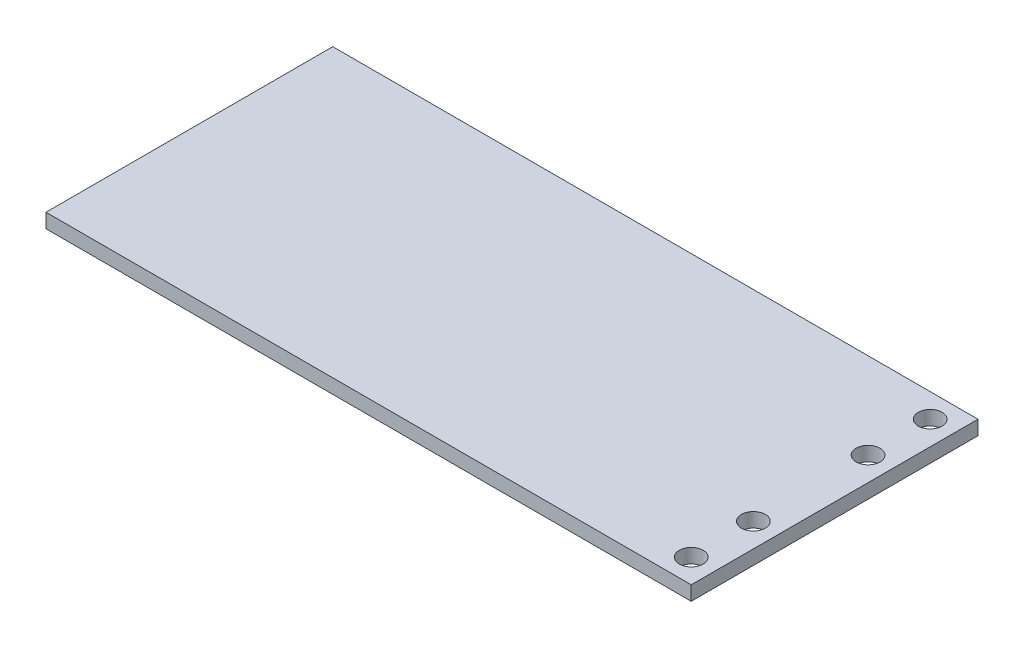
from build123d import *

# Parameters (mm, degrees)
BOSS_EXTRUDE1_DEPTH = 3


with BuildPart() as part:
    # Sketch1 → Boss-Extrude1 (new body)
    with BuildSketch(Plane(origin=(0, 0, 0), x_dir=(1, 0, 0), z_dir=(0, 1, 0))):
        with BuildLine():
            Line((130, 57.5), (130, 60))
            Line((130, 60), (0, 60))
            Line((0, 60), (0, 0))
            Line((0, 0), (130, 0))
            Line((130, 0), (130, 2.5))
            ThreePointArc((130, 2.5), (127.5, 5), (130, 7.5))
            Line((130, 7.5), (130, 15.5))
            ThreePointArc((130, 15.5), (127.5, 18), (130, 20.5))
            Line((130, 20.5), (130, 39.5))
            ThreePointArc((130, 39.5), (127.5, 42), (130, 44.5))
            Line((130, 44.5), (130, 52.5))
            ThreePointArc((130, 52.5), (127.5, 55), (130, 57.5))
        make_face()
        with BuildLine():
            Line((135, 60), (130, 60))
            Line((130, 60), (130, 57.5))
            ThreePointArc((130, 57.5), (131.767766953, 56.767766953), (132.5, 55))
            ThreePointArc((132.5, 55), (131.767766953, 53.232233047), (130, 52.5))
            Line((130, 52.5), (130, 44.5))
            ThreePointArc((130, 44.5), (131.767766953, 43.767766953), (132.5, 42))
            ThreePointArc((132.5, 42), (131.767766953, 40.232233047), (130, 39.5))
            Line((130, 39.5), (130, 20.5))
            ThreePointArc((130, 20.5), (131.767766953, 19.767766953), (132.5, 18))
            ThreePointArc((132.5, 18), (131.767766953, 16.232233047), (130, 15.5))
            Line((130, 15.5), (130, 7.5))
            ThreePointArc((130, 7.5), (131.767766953, 6.767766953), (132.5, 5))
            ThreePointArc((132.5, 5), (131.767766953, 3.232233047), (130, 2.5))
            Line((130, 2.5), (130, 0))
            Line((130, 0), (135, 0))
            Line((135, 0), (135, 60))
        make_face()
    extrude(amount=BOSS_EXTRUDE1_DEPTH)


solid = part.part
